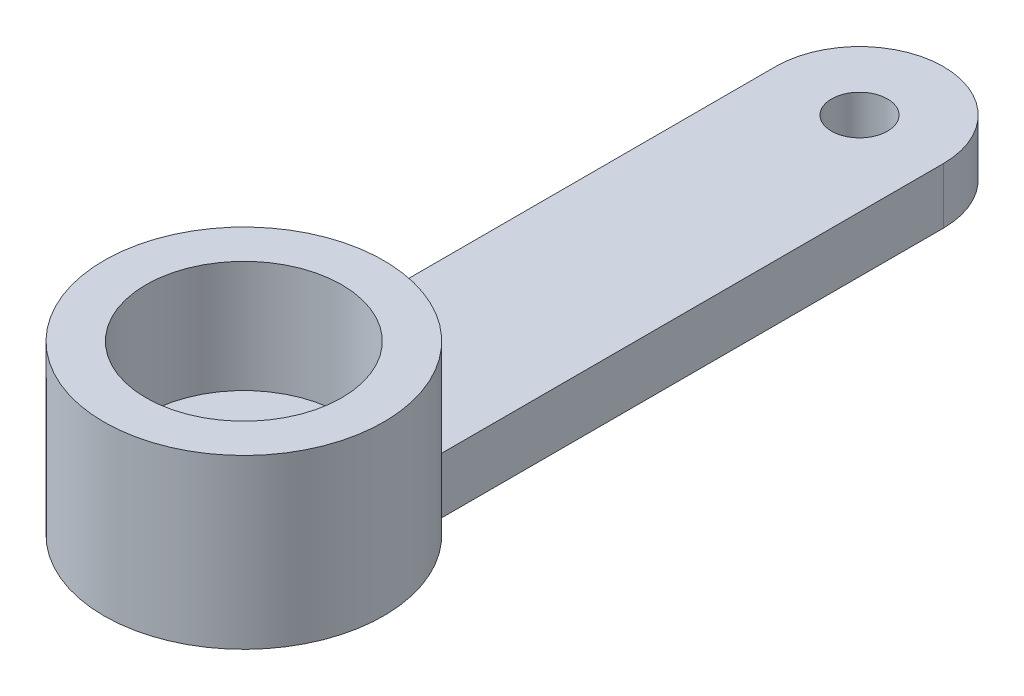
from build123d import *

# Parameters (mm, degrees)
SKETCH3_R           = 2.5
BOSS_EXTRUDE2_DEPTH = 1
SKETCH4_R           = 2.5
SKETCH4_R_2         = 1.75
BOSS_EXTRUDE3_DEPTH = 2
SKETCH5_R           = 0.5
CUT_EXTRUDE1_DEPTH  = 2


with BuildPart() as part:
    # Sketch3 → Boss-Extrude2 (new body)
    with BuildSketch(Plane(origin=(0, 0, 0), x_dir=(1, 0, 0), z_dir=(0, 1, 0))):
        with BuildLine():
            Line((-1.5, 11), (-1.5, 2))
            ThreePointArc((-1.5, 2), (0, 2.5), (1.5, 2))
            Line((1.5, 2), (1.5, 11))
            ThreePointArc((1.5, 11), (0, 12.5), (-1.5, 11))
        make_face()
        Circle(SKETCH3_R)
    extrude(amount=BOSS_EXTRUDE2_DEPTH)

    # Sketch4 → Boss-Extrude3 (add)
    with BuildSketch(Plane(origin=(0, 1, 0), x_dir=(1, 0, 0), z_dir=(0, 1, 0))):
        with Locations(Location((0, 0, 0), (0, 0, 53.130102354))):
            Circle(SKETCH4_R)
        with Locations(Location((0, 0, 0), (0, 0, 270))):
            Circle(SKETCH4_R_2, mode=Mode.SUBTRACT)
    extrude(amount=BOSS_EXTRUDE3_DEPTH)

    # Sketch5 → Cut-Extrude1 (cut)
    with BuildSketch(Plane.XZ):
        with Locations(Location((0, -11, 0), (0, 0, 270))):
            Circle(SKETCH5_R)
    extrude(amount=-CUT_EXTRUDE1_DEPTH, mode=Mode.SUBTRACT)


solid = part.part
